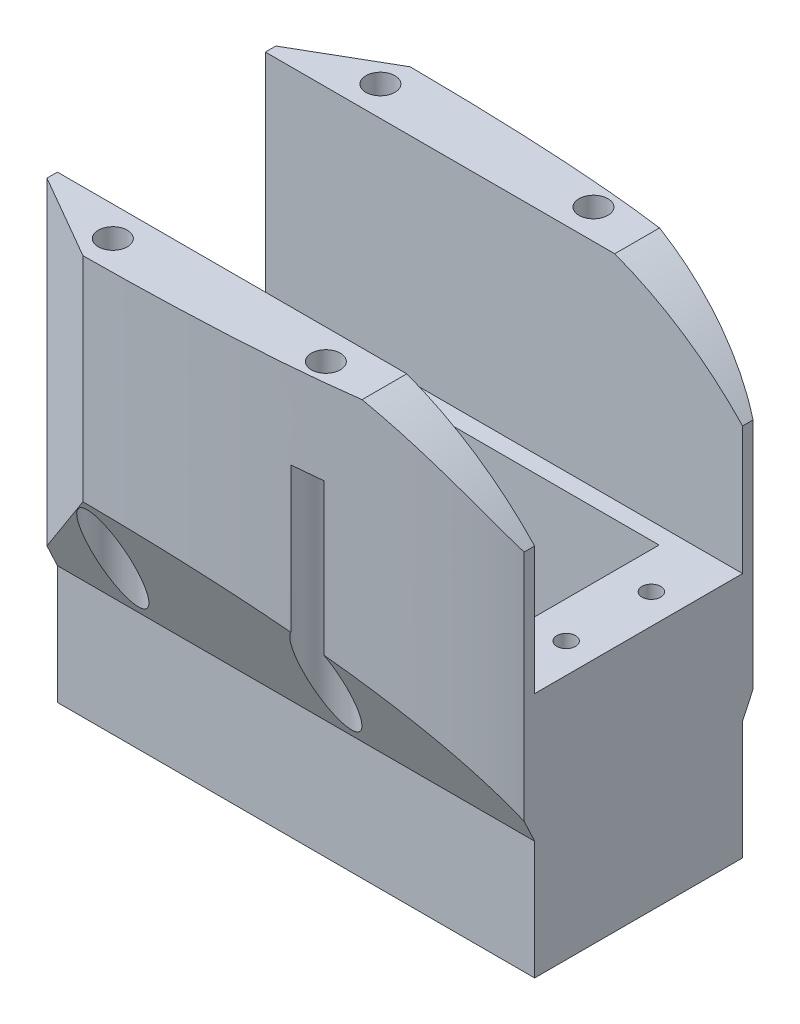
from build123d import *

# Parameters (mm, degrees)
SKETCH1_W               = 56
SKETCH1_H               = 24.4
SKETCH1_W_2             = 40.4
SKETCH1_H_2             = 20.4
BOSS_EXTRUDE1_DEPTH     = 27.9
SKETCH2_W               = 56
SKETCH2_H               = 24.4
BOSS_EXTRUDE2_DEPTH     = 1
BOSS_EXTRUDE3_DEPTH     = 56
SKETCH4_R               = 1.7
CUT_EXTRUDE1_DEPTH      = 79.056453929
CUT_EXTRUDE2_START      = -10
SKETCH5_R               = 3
CUT_EXTRUDE2_DEPTH      = 69.056453929
CHAMFER1_SIZE           = 10
CHAMFER1_SIZE2          = 5.773502692
CHAMFER2_SIZE           = 10
CHAMFER2_SIZE2          = 5.773502692
CHAMFER3_SIZE           = 10
CHAMFER3_SIZE2          = 5.773502692
CHAMFER4_SIZE           = 10
CHAMFER4_SIZE2          = 5.773502692
SKETCH6_W               = 7.8
SKETCH6_H               = 6
CUT_EXTRUDE3_DEPTH      = 27.9
SKETCH7_R               = 1.1
CUT_EXTRUDE4_DEPTH      = 30
CUT_EXTRUDE5_DEPTH      = 79.056453929
CUT_EXTRUDE6_DEPTH      = 79.151199776
CUT_EXTRUDE6_DEPTH_BACK = 79.151199776


with BuildPart() as part:
    # Sketch1 → Boss-Extrude1 (new body)
    with BuildSketch(Plane(origin=(0, 0, 0), x_dir=(1, 0, 0), z_dir=(0, 1, 0))):
        with Locations((20.2, 10.2)):
            Rectangle(SKETCH1_W, SKETCH1_H)
        with Locations((20.2, 10.2)):
            Rectangle(SKETCH1_W_2, SKETCH1_H_2, mode=Mode.SUBTRACT)
    extrude(amount=BOSS_EXTRUDE1_DEPTH)

    # Sketch2 → Boss-Extrude2 (add)
    with BuildSketch(Plane(origin=(0, 0, 0), x_dir=(-1, 0, 0), z_dir=(0, -1, 0))):
        with Locations((-20.2, 10.2)):
            Rectangle(SKETCH2_W, SKETCH2_H)
    extrude(amount=BOSS_EXTRUDE2_DEPTH)

    # Sketch3 → Boss-Extrude3 (add)
    with BuildSketch(Plane(origin=(48.2, 0, 0), x_dir=(0, 0, -1), z_dir=(1, 0, 0))):
        Polygon((22.4, 12.9), (29.4, 27.9), (29.4, 52.9), (22.4, 52.9), align=None)
    boss_extrude3 = extrude(amount=-BOSS_EXTRUDE3_DEPTH)

    # Sketch4 → Cut-Extrude1 (cut, through all)
    with BuildSketch(Plane(origin=(0, 52.9, 0), x_dir=(1, 0, 0), z_dir=(0, 1, 0))):
        with Locations(Location((2.2, 25.9, 0), (0, 0, 270))):
            Circle(SKETCH4_R)
        with Locations(Location((27.2, 25.9, 0), (0, 0, 270))):
            Circle(SKETCH4_R)
    cut_extrude1 = extrude(amount=-CUT_EXTRUDE1_DEPTH, mode=Mode.SUBTRACT)

    # Sketch5 → Cut-Extrude2 (cut, through all)
    with BuildSketch(Plane(origin=(0, 52.9, 0), x_dir=(1, 0, 0), z_dir=(0, 1, 0)).offset(CUT_EXTRUDE2_START)):
        with Locations(Location((2.2, 25.9, 0), (0, 0, 270))):
            Circle(SKETCH5_R)
        with Locations(Location((27.2, 25.9, 0), (0, 0, 270))):
            Circle(SKETCH5_R)
    cut_extrude2 = extrude(amount=-CUT_EXTRUDE2_DEPTH, mode=Mode.SUBTRACT)

    # Mirror1: Boss-Extrude3, Cut-Extrude1, Cut-Extrude2 across plane
    add(boss_extrude3.mirror(Plane.XY.offset(-10.2)))
    add(cut_extrude1.mirror(Plane.XY.offset(-10.2)), mode=Mode.SUBTRACT)
    add(cut_extrude2.mirror(Plane.XY.offset(-10.2)), mode=Mode.SUBTRACT)

    # Chamfer1
    chamfer1_edges = [part.edges().sort_by_distance(p)[0] for p in [
        (-7.8, 40.4, -29.4),
    ]]
    chamfer1_side = [part.faces().sort_by_distance(p)[0] for p in [
        (20.2, 40.4, -29.4),
    ]]
    chamfer(chamfer1_edges, length=CHAMFER1_SIZE, length2=CHAMFER1_SIZE2, reference=chamfer1_side[0])

    # Chamfer2
    chamfer2_edges = [part.edges().sort_by_distance(p)[0] for p in [
        (48.2, 40.4, -29.4),
    ]]
    chamfer2_side = [part.faces().sort_by_distance(p)[0] for p in [
        (25.2, 40.4, -29.4),
    ]]
    chamfer(chamfer2_edges, length=CHAMFER2_SIZE, length2=CHAMFER2_SIZE2, reference=chamfer2_side[0])

    # Chamfer3
    chamfer3_edges = [part.edges().sort_by_distance(p)[0] for p in [
        (-7.8, 40.4, 9),
    ]]
    chamfer3_side = [part.faces().sort_by_distance(p)[0] for p in [
        (20.2, 40.4, 9),
    ]]
    chamfer(chamfer3_edges, length=CHAMFER3_SIZE, length2=CHAMFER3_SIZE2, reference=chamfer3_side[0])

    # Chamfer4
    chamfer4_edges = [part.edges().sort_by_distance(p)[0] for p in [
        (48.2, 40.4, 9),
    ]]
    chamfer4_side = [part.faces().sort_by_distance(p)[0] for p in [
        (25.2, 40.4, 9),
    ]]
    chamfer(chamfer4_edges, length=CHAMFER4_SIZE, length2=CHAMFER4_SIZE2, reference=chamfer4_side[0])

    # Sketch6 → Cut-Extrude3 (cut)
    with BuildSketch(Plane(origin=(0, 27.9, 0), x_dir=(1, 0, 0), z_dir=(0, 1, 0))):
        with Locations((-3.9, 10.2)):
            Rectangle(SKETCH6_W, SKETCH6_H)
    extrude(amount=-CUT_EXTRUDE3_DEPTH, mode=Mode.SUBTRACT)

    # Sketch7 → Cut-Extrude4 (cut)
    with BuildSketch(Plane(origin=(0, 27.9, 0), x_dir=(1, 0, 0), z_dir=(0, 1, 0))):
        with Locations(Location((-4.3, 15.2, 0), (0, 0, 270))):
            Circle(SKETCH7_R)
        with Locations(Location((-4.3, 5.2, 0), (0, 0, 270))):
            Circle(SKETCH7_R)
        with Locations(Location((44.7, 15.2, 0), (0, 0, 270))):
            Circle(SKETCH7_R)
        with Locations(Location((44.7, 5.2, 0), (0, 0, 270))):
            Circle(SKETCH7_R)
    extrude(amount=-CUT_EXTRUDE4_DEPTH, mode=Mode.SUBTRACT)

    # Sketch8 → Cut-Extrude5 (cut, symmetric)
    with BuildSketch(Plane(origin=(0, 52.9, 0), x_dir=(1, 0, 0), z_dir=(0, 1, 0))):
        with BuildLine():
            add(Edge.make_bspline(
                [(2.2, 29.4), (38.687561205, 29.118506407), (48.2, 23.626497308)],
                knots=[0, 0, 0, 1, 1, 1], degree=2))
            Line((48.2, 23.626497308), (38.2, 29.4))
            Line((38.2, 29.4), (2.2, 29.4))
        make_face()
    cut_extrude5 = extrude(amount=CUT_EXTRUDE5_DEPTH, both=True, mode=Mode.SUBTRACT)

    # Mirror2: Cut-Extrude5 across plane
    add(cut_extrude5.mirror(Plane.XY.offset(-10.2)), mode=Mode.SUBTRACT)

    # Sketch9 → Cut-Extrude6 (cut, two sides: drawn at the far end of the back side and taken through both)
    with BuildSketch(Plane.XY.offset(2).offset(-CUT_EXTRUDE6_DEPTH_BACK)):
        with BuildLine():
            Line((33.2, 52.9), (48.2, 52.9))
            Line((48.2, 52.9), (48.2, 42.9))
            ThreePointArc((48.2, 42.9), (41.270707085, 48.756060628), (33.2, 52.9))
        make_face()
    extrude(amount=CUT_EXTRUDE6_DEPTH + CUT_EXTRUDE6_DEPTH_BACK, mode=Mode.SUBTRACT)


solid = part.part
